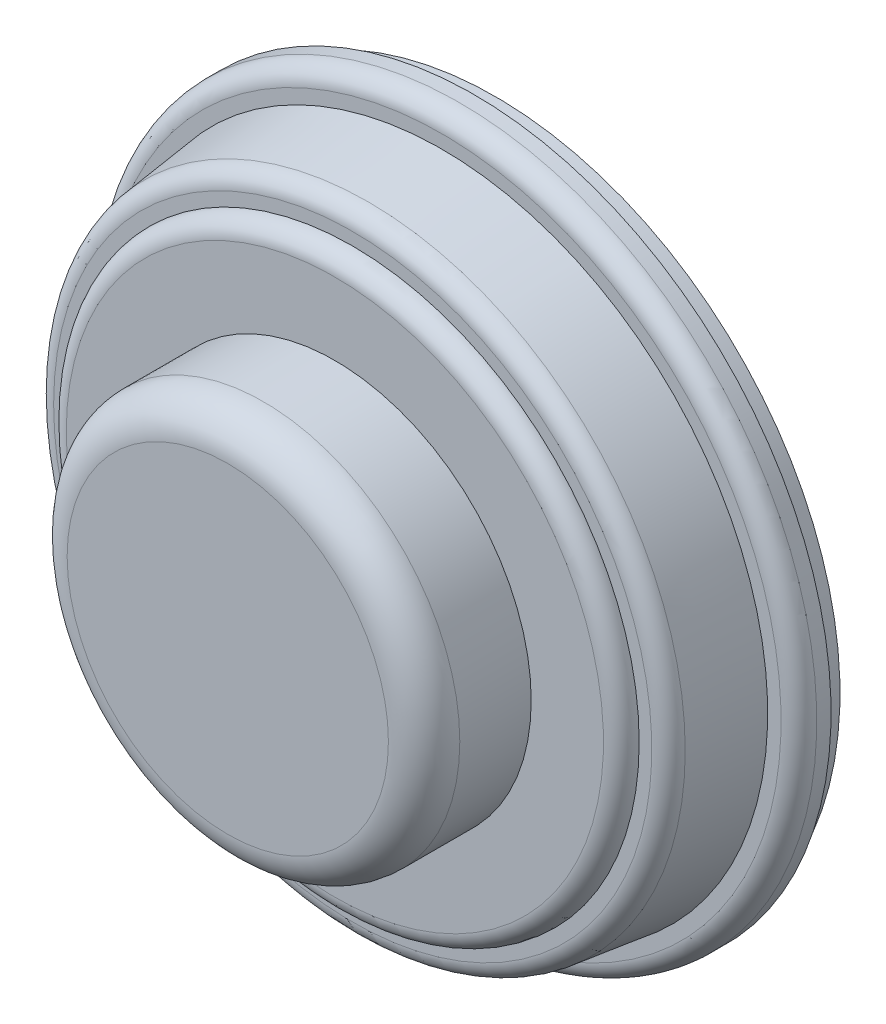
from build123d import *


with BuildPart() as part:
    # Эскиз1 → Повернуть1 (revolve)
    with BuildSketch(Plane(origin=(0, 0, 0), x_dir=(1, 0, 0), z_dir=(0, 1, 0)), mode=Mode.PRIVATE) as revolve_1_sk:
        with BuildLine():
            Line((0, -0.2), (0, -15))
            Line((0, -15), (9, -15))
            ThreePointArc((9, -15), (10.414213562, -14.414213562), (11, -13))
            Line((11, -13), (11, -9))
            Line((11, -9), (15.05, -9))
            ThreePointArc((15.05, -9), (15.757106781, -8.707106781), (16.05, -8))
            Line((16.05, -8), (16.757282057, -8))
            ThreePointArc((16.757282057, -8), (17.420432881, -7.748485795), (17.75, -7.120461971))
            Line((17.75, -7.120461971), (18.25, -3))
            Line((18.25, -3), (19, -3))
            ThreePointArc((19, -3), (19.707106781, -2.707106781), (20, -2))
            Line((20, -2), (20, -1.2))
            Line((20, -1.2), (19.3, -1.2))
            Line((19.3, -1.2), (19.3, 0))
            Line((19.3, 0), (18.3, 0))
            Line((18.3, 0), (18.3, -2.5))
            Line((18.3, -2.5), (17.8, -2.5))
            ThreePointArc((17.8, -2.5), (15.15, -0.5), (12.5, -2.5))
            Line((12.5, -2.5), (9.5, -2.5))
            ThreePointArc((9.5, -2.5), (4.887228253, -0.783187649), (0, -0.2))
        make_face()
    revolve(revolve_1_sk.sketch.rotate(Axis((0, 0, 0), (0, 0, 1)), 180), axis=Axis((0, 0, 0), (0, 0, 1)))


solid = part.part
